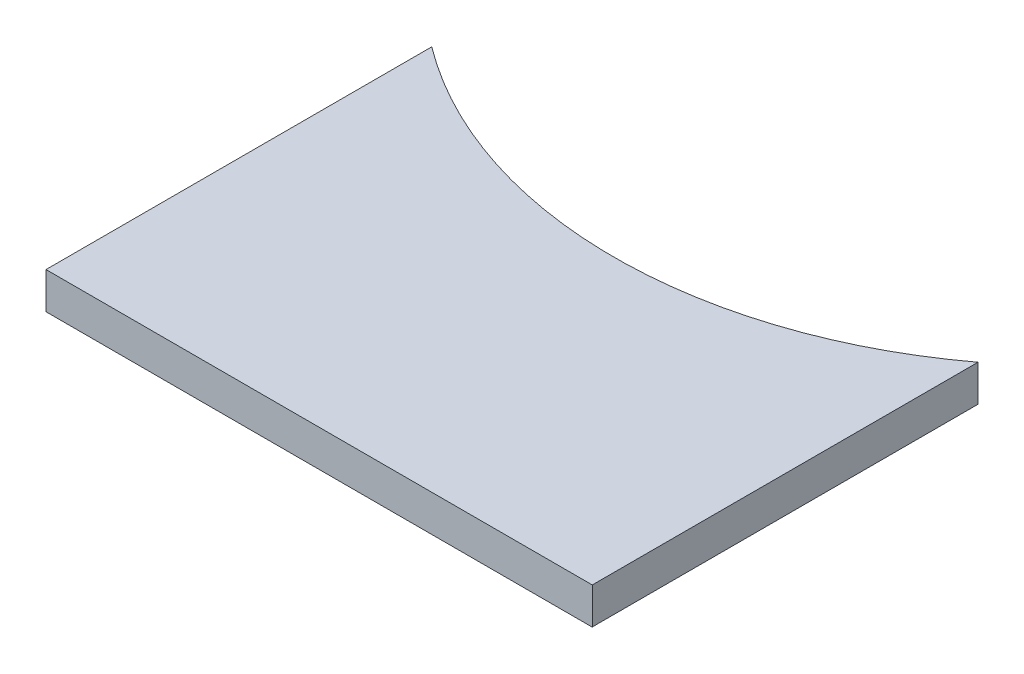
from build123d import *

# Parameters (mm, degrees)
SKETCH1_W           = 30
SKETCH1_H           = 25
BOSS_EXTRUDE1_DEPTH = 2
SKETCH2_W           = 30
SKETCH2_H           = 2
BOSS_EXTRUDE2_DEPTH = 12.5
CUT_EXTRUDE1_REACH  = 25.184
SKETCH3_R           = 25
FILLET1_R           = 2
CUT_EXTRUDE2_REACH  = 26.321
SKETCH4_W           = 35.566243018
SKETCH4_H           = 17.679126646


with BuildPart() as part:
    # Sketch1 → Boss-Extrude1 (new body)
    with BuildSketch(Plane(origin=(0, 0, 0), x_dir=(1, 0, 0), z_dir=(0, 1, 0))):
        Rectangle(SKETCH1_W, SKETCH1_H)
    extrude(amount=BOSS_EXTRUDE1_DEPTH)

    # Sketch2 → Boss-Extrude2 (add)
    with BuildSketch(Plane(origin=(0, 0, 0), x_dir=(1, 0, 0), z_dir=(0, 1, 0))):
        with Locations((0, -11.5)):
            Rectangle(SKETCH2_W, SKETCH2_H)
    extrude(amount=-BOSS_EXTRUDE2_DEPTH)

    # Sketch3 → Cut-Extrude1 (cut, up to next)
    with BuildSketch(Plane(origin=(0, 0, 0), x_dir=(1, 0, 0), z_dir=(0, 1, 0)), mode=Mode.PRIVATE) as cut_extrude1_sk1:
        with Locations((0, 32.5)):
            Circle(SKETCH3_R)
    cut_extrude1_tool1 = extrude(cut_extrude1_sk1.sketch, amount=CUT_EXTRUDE1_REACH, mode=Mode.PRIVATE) & part.part
    add(cut_extrude1_tool1.solids().sort_by_distance((0, 0, -32.5))[0], mode=Mode.SUBTRACT)

    # Fillet1
    fillet1_edges = [part.edges().sort_by_distance(p)[0] for p in [
        (0, 0, 10.5),
    ]]
    fillet(fillet1_edges, radius=FILLET1_R)

    # Sketch4 → Cut-Extrude2 (cut, up to next)
    with BuildSketch(Plane(origin=(0, 2, 0), x_dir=(1, 0, 0), z_dir=(0, 1, 0)), mode=Mode.PRIVATE) as cut_extrude2_sk1:
        with Locations((0, -17.523134352)):
            Rectangle(SKETCH4_W, SKETCH4_H)
    cut_extrude2_tool1 = extrude(cut_extrude2_sk1.sketch, amount=-CUT_EXTRUDE2_REACH, mode=Mode.PRIVATE) & part.part
    add(cut_extrude2_tool1.solids().sort_by_distance((0, 2, 17.523134))[0], mode=Mode.SUBTRACT)


solid = part.part
